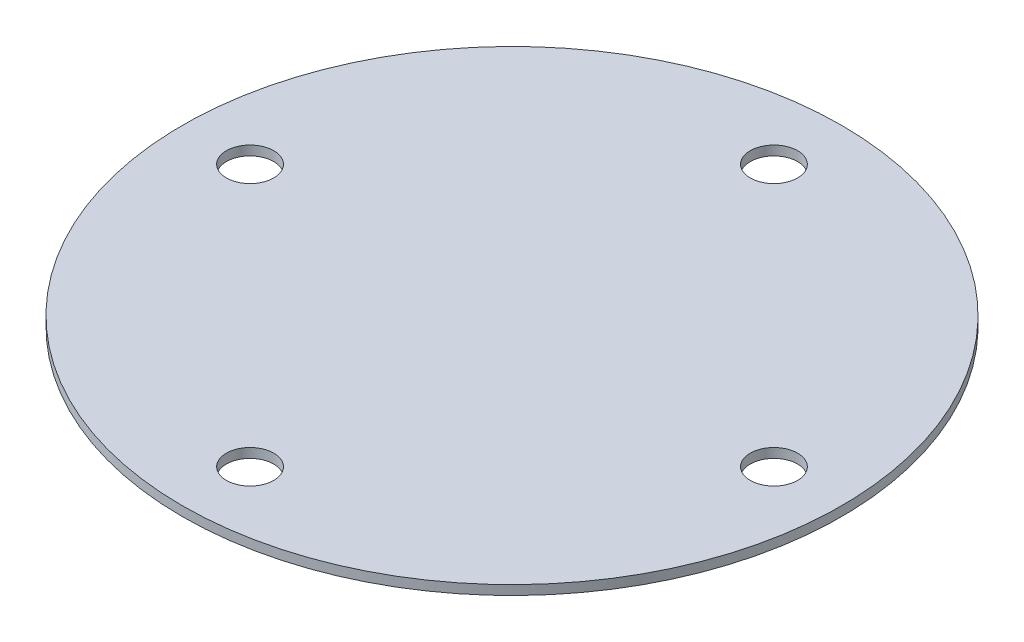
from build123d import *

# Parameters (mm, degrees)
SKETCH1_R           = 88.519
BOSS_EXTRUDE1_DEPTH = 2.54
SKETCH2_R           = 6.35
CUT_EXTRUDE1_DEPTH  = 126.210535986


with BuildPart() as part:
    # Sketch1 → Boss-Extrude1 (new body)
    with BuildSketch(Plane(origin=(0, 0, 0), x_dir=(1, 0, 0), z_dir=(0, 1, 0))):
        with Locations(Location((0, 0, 0), (0, 0, 270))):
            Circle(SKETCH1_R)
    extrude(amount=BOSS_EXTRUDE1_DEPTH)

    # Sketch2 → Cut-Extrude1 (cut, through all)
    with BuildSketch(Plane(origin=(0, 2.54, 0), x_dir=(1, 0, 0), z_dir=(0, 1, 0))):
        with Locations(Location((0, 70.358, 0), (0, 0, 270))):
            Circle(SKETCH2_R)
        with Locations(Location((70.358, 0, 0), (0, 0, 270))):
            Circle(SKETCH2_R)
        with Locations(Location((0, -70.358, 0), (0, 0, 270))):
            Circle(SKETCH2_R)
        with Locations(Location((-70.358, 0, 0), (0, 0, 270))):
            Circle(SKETCH2_R)
    extrude(amount=-CUT_EXTRUDE1_DEPTH, mode=Mode.SUBTRACT)


solid = part.part
